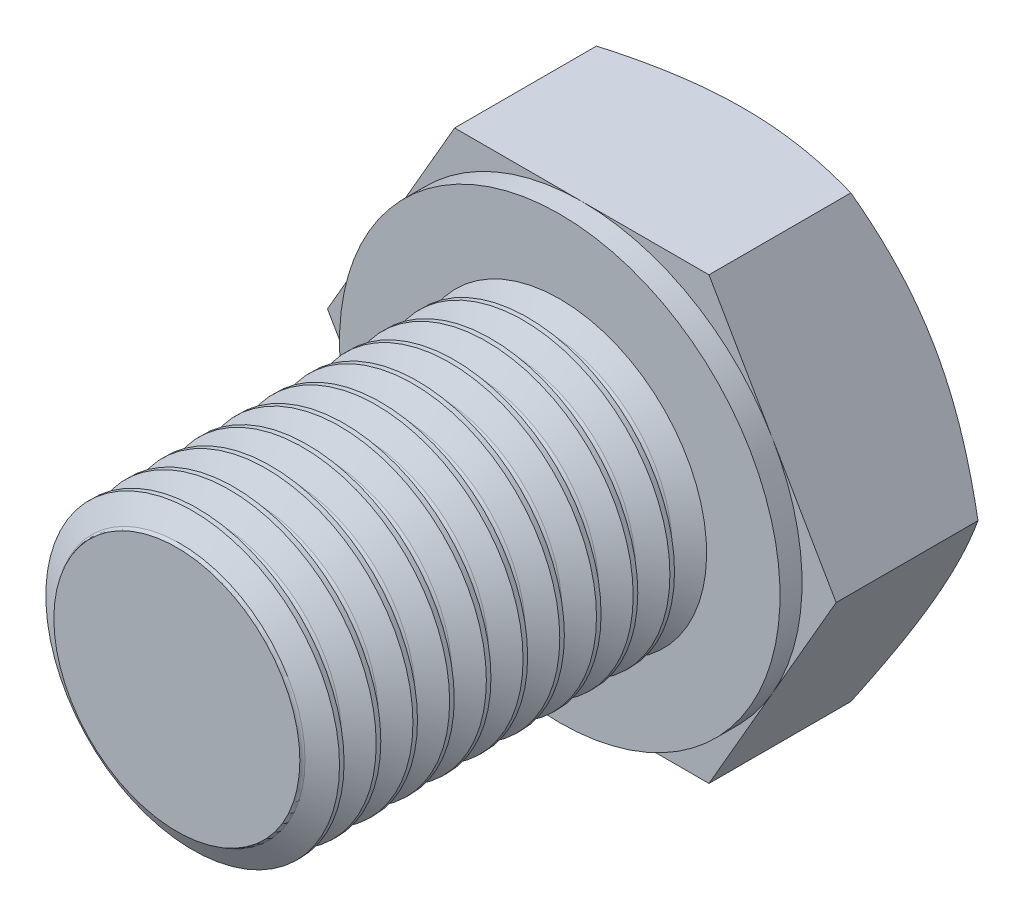
from build123d import *

# Parameters (mm, degrees)
SKETCH5_W               = 120
SKETCH5_H               = 10
THREAD_SIMPLE_COUNT     = 48
THREAD_SIMPLE_PITCH     = 2.5
SKETCH15_W              = 12.5
SKETCH15_H              = 20
SKETCH19_W              = 1.5
SKETCH19_H              = 5
SKETCH21_OUTSIDE_W      = 70.814
SKETCH21_OUTSIDE_H      = 70.814
CUT_PROFILE_OUTER_DEPTH = 124.288280059
CUT_EXTRUDE1_DEPTH      = 21
CUT_EXTRUDE1_DEPTH_BACK = 29
SKETCH23_W              = 78.955821896
SKETCH23_H              = 110.698052137


with BuildPart() as part:
    # Sketch5 → body (revolve)
    with BuildSketch(Plane(origin=(0, 0, 0), x_dir=(0, 0, -1), z_dir=(1, 0, 0)), mode=Mode.PRIVATE) as body_sk:
        with Locations((-60, 5)):
            Rectangle(SKETCH5_W, SKETCH5_H)
    revolve(body_sk.sketch.rotate(Axis((0, 0, 120), (0, 0, -1)), 180), axis=Axis((0, 0, 120), (0, 0, -1)))

    # Sketch11 → cut-chamfer-start (revolve, cut)
    with BuildSketch(Plane(origin=(0, 0, 0), x_dir=(0, 0, -1), z_dir=(1, 0, 0))):
        Polygon((-120, -10), (-120, -8), (-118, -10), align=None)
    revolve(axis=Axis((0, 0, 120), (0, 0, -1)), mode=Mode.SUBTRACT)

    # Sketch8 → thread-single (revolve, cut)
    with BuildSketch(Plane(origin=(0, 0, 0), x_dir=(0, 0, -1), z_dir=(1, 0, 0)), mode=Mode.PRIVATE) as thread_single_sk:
        with BuildLine():
            Line((-2.1875, -10), (0, -10))
            Line((0, -10), (-0.859375, -8.511518837))
            ThreePointArc((-0.859375, -8.511518837), (-1.09375, -8.376202368), (-1.328125, -8.511518837))
            Line((-1.328125, -8.511518837), (-2.1875, -10))
        make_face()
    thread_single = revolve(thread_single_sk.sketch.rotate(Axis((0, 0, 120), (0, 0, -1)), 270), axis=Axis((0, 0, 120), (0, 0, -1)), mode=Mode.SUBTRACT)

    # thread-simple: thread-single ×48
    with Locations(*[(0, 0, i * THREAD_SIMPLE_PITCH) for i in range(1, THREAD_SIMPLE_COUNT)]):
        add(thread_single, mode=Mode.SUBTRACT)

    # Sketch15 → body-head (revolve)
    with BuildSketch(Plane(origin=(0, 0, 0), x_dir=(0, 0, -1), z_dir=(1, 0, 0)), mode=Mode.PRIVATE) as body_head_sk:
        with Locations((6.25, -10)):
            Rectangle(SKETCH15_W, SKETCH15_H)
    revolve(body_head_sk.sketch.rotate(Axis((0, 0, -12.5), (0, 0, 1)), 90), axis=Axis((0, 0, -12.5), (0, 0, 1)))

    # Sketch19 → cut-head-profile (revolve, cut)
    with BuildSketch(Plane(origin=(0, 0, 0), x_dir=(0, 0, -1), z_dir=(1, 0, 0)), mode=Mode.PRIVATE) as cut_head_profile_sk:
        with Locations((0.75, -17.5)):
            Rectangle(SKETCH19_W, SKETCH19_H)
        Polygon((12.5, -20), (12.5, -15), (9.613248654, -20), align=None)
    revolve(cut_head_profile_sk.sketch.rotate(Axis((0, 0, -12.5), (0, 0, 1)), 90), axis=Axis((0, 0, -12.5), (0, 0, 1)), mode=Mode.SUBTRACT)

    # Sketch21 outside → cut-profile-outer (cut, through all)
    with BuildSketch(Plane.XY):
        Rectangle(SKETCH21_OUTSIDE_W, SKETCH21_OUTSIDE_H)
        Polygon((17.320508076, 0), (8.660254038, 15), (-8.660254038, 15), (-17.320508076, 0), (-8.660254038, -15), (8.660254038, -15), align=None, mode=Mode.SUBTRACT)
    extrude(amount=-CUT_PROFILE_OUTER_DEPTH, mode=Mode.SUBTRACT)

    # Sketch23 → Cut-Extrude1 (cut, two sides: drawn at the far end of the back side and taken through both)
    with BuildSketch(Plane(origin=(0, 0, 0), x_dir=(1, 0, 0), z_dir=(0, 1, 0)).offset(-CUT_EXTRUDE1_DEPTH_BACK)):
        with Locations((-5.291248858, -81.42572472)):
            Rectangle(SKETCH23_W, SKETCH23_H)
    extrude(amount=CUT_EXTRUDE1_DEPTH + CUT_EXTRUDE1_DEPTH_BACK, mode=Mode.SUBTRACT)


solid = part.part
